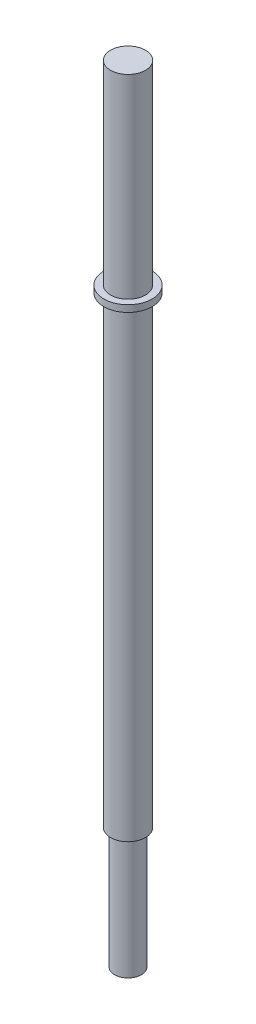
from build123d import *

# Parameters (mm, degrees)
SKETCH1_W = 0.254
SKETCH1_H = 0.254


with BuildPart() as part:
    # Sketch1 → Revolve2 (revolve)
    with BuildSketch(Plane.XY, mode=Mode.PRIVATE) as revolve2_sk:
        Polygon((0, -29.718), (0, 0), (0.6604, 0), (0.6604, -25.146), (0.508, -25.146), (0.508, -29.718), align=None)
        with Locations((0.7874, -7.493)):
            Rectangle(SKETCH1_W, SKETCH1_H)
    revolve(revolve2_sk.sketch.rotate(Axis((0, 0, 0), (0, 1, 0)), 90), axis=Axis((0, 0, 0), (0, 1, 0)))


solid = part.part
